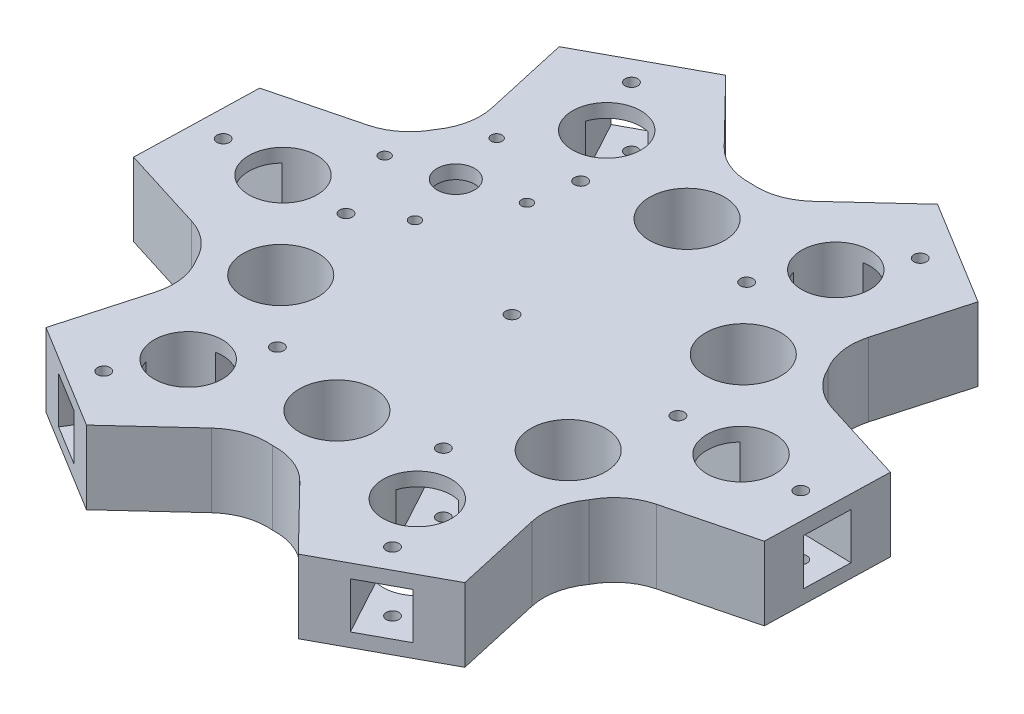
from build123d import *

# Parameters (mm, degrees)
CROQUIS2_R              = 1.85
CROQUIS2_R_2            = 10
CROQUIS2_R_3            = 11
SALIENTE_EXTRUIR1_DEPTH = 21.5
CROQUIS3_W              = 13.5
CROQUIS3_H              = 13.5
CORTAR_EXTRUIR1_DEPTH   = 227.063412752
MATRIZC1_COUNT          = 6
SALIENTE_EXTRUIR2_START = -4
CROQUIS4_R              = 11
CROQUIS4_R_2            = 5.5
SALIENTE_EXTRUIR2_DEPTH = 4
CORTAR_EXTRUIR2_START   = -10
CROQUIS5_R              = 1.6
CROQUIS5_R_2            = 5.5
CORTAR_EXTRUIR2_DEPTH   = 10


with BuildPart() as part:
    # Croquis2 → Saliente-Extruir1 (new body)
    with BuildSketch(Plane(origin=(0, 0, 0), x_dir=(1, 0, 0), z_dir=(0, 1, 0))):
        with BuildLine():
            Line((34.338474425, 90.387328615), (65.023396068, 71.560868943))
            Line((65.023396068, 71.560868943), (57.99870039, 46.557847845))
            ThreePointArc((57.99870039, 46.557847845), (57.540985683, 39.344606317), (60.071411753, 32.574281363))
            ThreePointArc((60.071411753, 32.574281363), (64.365061572, 26.760080874), (70.66006642, 23.20856429))
            Line((70.66006642, 23.20856429), (95.446959973, 15.455673128))
            Line((95.446959973, 15.455673128), (94.485228455, -20.531478364))
            Line((94.485228455, -20.531478364), (69.319629174, -26.949424002))
            ThreePointArc((69.319629174, -26.949424002), (62.843921414, -30.159652201), (58.245861047, -35.736227938))
            ThreePointArc((58.245861047, -35.736227938), (55.357440631, -42.361738001), (55.42923947, -49.589130408))
            Line((55.42923947, -49.589130408), (61.108485548, -74.931655487))
            Line((61.108485548, -74.931655487), (29.461832387, -92.092347306))
            Line((29.461832387, -92.092347306), (11.320928784, -73.507271847))
            ThreePointArc((11.320928784, -73.507271847), (5.302935731, -69.504258519), (-1.825550706, -68.310509301))
            ThreePointArc((-1.825550706, -68.310509301), (-9.007620942, -69.121818875), (-15.23082695, -72.797694698))
            Line((-15.23082695, -72.797694698), (-34.338474425, -90.387328615))
            Line((-34.338474425, -90.387328615), (-65.023396068, -71.560868943))
            Line((-65.023396068, -71.560868943), (-57.99870039, -46.557847845))
            ThreePointArc((-57.99870039, -46.557847845), (-57.540985683, -39.344606317), (-60.071411753, -32.574281363))
            ThreePointArc((-60.071411753, -32.574281363), (-64.365061572, -26.760080874), (-70.66006642, -23.20856429))
            Line((-70.66006642, -23.20856429), (-95.446959973, -15.455673128))
            Line((-95.446959973, -15.455673128), (-94.485228455, 20.531478364))
            Line((-94.485228455, 20.531478364), (-69.319629174, 26.949424002))
            ThreePointArc((-69.319629174, 26.949424002), (-62.843921414, 30.159652201), (-58.245861047, 35.736227938))
            ThreePointArc((-58.245861047, 35.736227938), (-55.357440631, 42.361738001), (-55.42923947, 49.589130408))
            Line((-55.42923947, 49.589130408), (-61.108485548, 74.931655487))
            Line((-61.108485548, 74.931655487), (-29.461832387, 92.092347306))
            Line((-29.461832387, 92.092347306), (-11.320928784, 73.507271847))
            ThreePointArc((-11.320928784, 73.507271847), (-5.302935731, 69.504258519), (1.825550706, 68.310509301))
            ThreePointArc((1.825550706, 68.310509301), (9.007620942, 69.121818875), (15.23082695, 72.797694698))
            Line((15.23082695, 72.797694698), (34.338474425, 90.387328615))
        make_face()
        with Locations(Location((45.497277541, 74.155227303, 0), (0, 0, 270))):
            Circle(CROQUIS2_R, mode=Mode.SUBTRACT)
        with Locations(Location((26.147860656, 42.617946726, 0), (0, 0, 270))):
            Circle(CROQUIS2_R, mode=Mode.SUBTRACT)
        with Locations(Location((36.084047705, 58.812766481, 0), (0, 0, 270))):
            Circle(CROQUIS2_R_2, mode=Mode.SUBTRACT)
        with Locations(Location((0, 0, 0), (0, 0, 270))):
            Circle(CROQUIS2_R, mode=Mode.SUBTRACT)
        with Locations(Location((43.953684946, 23.834294194, 0), (0, 0, 270))):
            Circle(CROQUIS2_R_3, mode=Mode.SUBTRACT)
        with Locations(Location((68.975373692, -1.843318743, 0), (0, 0, 270))):
            Circle(CROQUIS2_R_2, mode=Mode.SUBTRACT)
        with Locations(Location((86.968949438, -2.324184502, 0), (0, 0, 270))):
            Circle(CROQUIS2_R, mode=Mode.SUBTRACT)
        with Locations(Location((49.98215485, -1.33573822, 0), (0, 0, 270))):
            Circle(CROQUIS2_R, mode=Mode.SUBTRACT)
        with Locations(Location((42.617946726, -26.147860656, 0), (0, 0, 270))):
            Circle(CROQUIS2_R_3, mode=Mode.SUBTRACT)
        with Locations(Location((32.891325987, -60.656085225, 0), (0, 0, 270))):
            Circle(CROQUIS2_R_2, mode=Mode.SUBTRACT)
        with Locations(Location((41.471671897, -76.479411805, 0), (0, 0, 270))):
            Circle(CROQUIS2_R, mode=Mode.SUBTRACT)
        with Locations(Location((23.834294194, -43.953684946, 0), (0, 0, 270))):
            Circle(CROQUIS2_R, mode=Mode.SUBTRACT)
        with Locations(Location((-1.33573822, -49.98215485, 0), (0, 0, 270))):
            Circle(CROQUIS2_R_3, mode=Mode.SUBTRACT)
        with Locations(Location((-36.084047705, -58.812766481, 0), (0, 0, 270))):
            Circle(CROQUIS2_R_2, mode=Mode.SUBTRACT)
        with Locations(Location((-45.497277541, -74.155227303, 0), (0, 0, 270))):
            Circle(CROQUIS2_R, mode=Mode.SUBTRACT)
        with Locations(Location((-26.147860656, -42.617946726, 0), (0, 0, 270))):
            Circle(CROQUIS2_R, mode=Mode.SUBTRACT)
        with Locations(Location((-43.953684946, -23.834294194, 0), (0, 0, 270))):
            Circle(CROQUIS2_R_3, mode=Mode.SUBTRACT)
        with Locations(Location((-68.975373692, 1.843318743, 0), (0, 0, 270))):
            Circle(CROQUIS2_R_2, mode=Mode.SUBTRACT)
        with Locations(Location((-86.968949438, 2.324184502, 0), (0, 0, 270))):
            Circle(CROQUIS2_R, mode=Mode.SUBTRACT)
        with Locations(Location((-49.98215485, 1.33573822, 0), (0, 0, 270))):
            Circle(CROQUIS2_R, mode=Mode.SUBTRACT)
        with Locations(Location((-42.617946726, 26.147860656, 0), (0, 0, 270))):
            Circle(CROQUIS2_R_3, mode=Mode.SUBTRACT)
        with Locations(Location((-32.891325987, 60.656085225, 0), (0, 0, 270))):
            Circle(CROQUIS2_R_2, mode=Mode.SUBTRACT)
        with Locations(Location((-41.471671897, 76.479411805, 0), (0, 0, 270))):
            Circle(CROQUIS2_R, mode=Mode.SUBTRACT)
        with Locations(Location((-23.834294194, 43.953684946, 0), (0, 0, 270))):
            Circle(CROQUIS2_R, mode=Mode.SUBTRACT)
        with Locations(Location((1.33573822, 49.98215485, 0), (0, 0, 270))):
            Circle(CROQUIS2_R_3, mode=Mode.SUBTRACT)
    extrude(amount=SALIENTE_EXTRUIR1_DEPTH)

    # Croquis3 → Cortar-Extruir1 (cut, through all)
    with BuildSketch(Plane(origin=(45.285158968, 0, 83.512001397), x_dir=(0.8790736989108549, 0, -0.4766858838723754), z_dir=(0.4766858838723755, 0, 0.879073698910855))):
        with Locations((0, 10.75)):
            Rectangle(CROQUIS3_W, CROQUIS3_H)
    cortar_extruir1 = extrude(amount=-CORTAR_EXTRUIR1_DEPTH, mode=Mode.SUBTRACT)

    # MatrizC1: Cortar-Extruir1 ×6 about axis
    matrizc1_axis = Axis((0, 0, 0), (0, 1, 0))
    for i in range(1, MATRIZC1_COUNT):
        add(cortar_extruir1.rotate(matrizc1_axis, i * 360 / MATRIZC1_COUNT), mode=Mode.SUBTRACT)

    # Croquis4 → Saliente-Extruir2 (add)
    with BuildSketch(Plane(origin=(0, 21.5, 0), x_dir=(1, 0, 0), z_dir=(0, 1, 0)).offset(SALIENTE_EXTRUIR2_START)):
        with Locations(Location((-42.617946726, 26.147860656, 0), (0, 0, 270))):
            Circle(CROQUIS4_R)
        with Locations(Location((-42.617946726, 26.147860656, 0), (0, 0, 270))):
            Circle(CROQUIS4_R_2, mode=Mode.SUBTRACT)
    extrude(amount=SALIENTE_EXTRUIR2_DEPTH)

    # Croquis5 → Cortar-Extruir2 (cut)
    with BuildSketch(Plane(origin=(0, 21.5, 0), x_dir=(1, 0, 0), z_dir=(0, 1, 0)).offset(CORTAR_EXTRUIR2_START)):
        with Locations(Location((-47.056631996, 42.558164525, 0), (0, 0, 270))):
            Circle(CROQUIS5_R)
        with Locations(Location((-42.617946726, 26.147860656, 0), (0, 0, 270))):
            Circle(CROQUIS5_R_2)
        with Locations(Location((-26.207642857, 30.586545927, 0), (0, 0, 270))):
            Circle(CROQUIS5_R)
        with Locations(Location((-38.179261455, 9.737556787, 0), (0, 0, 270))):
            Circle(CROQUIS5_R)
        with Locations(Location((-59.028250595, 21.709175385, 0), (0, 0, 270))):
            Circle(CROQUIS5_R)
    extrude(amount=CORTAR_EXTRUIR2_DEPTH, mode=Mode.SUBTRACT)


solid = part.part
